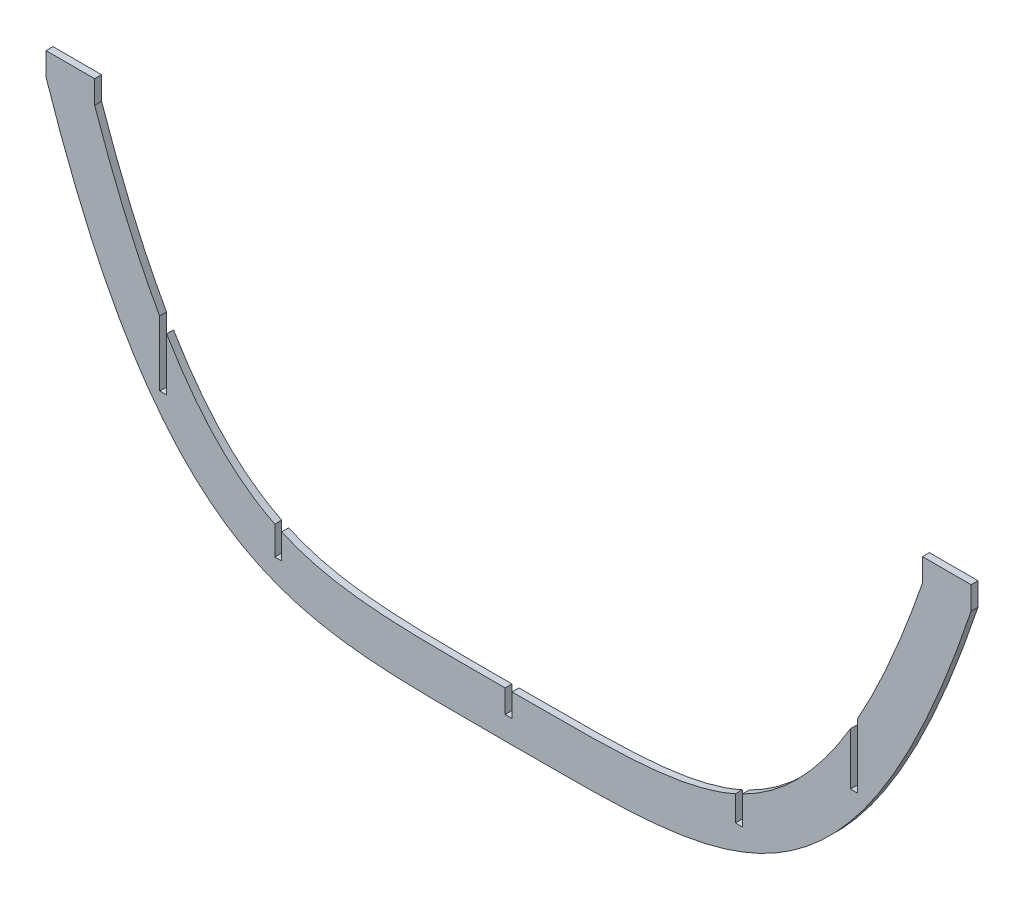
from build123d import *

# Parameters (mm, degrees)
BOSS_EXTRUDE1_DEPTH = 3
SKETCH2_W           = 2.999999902
SKETCH2_H           = 11.368148841
CUT_EXTRUDE2_DEPTH  = 22
SKETCH4_W           = 3
SKETCH4_H           = 12.91245629
CUT_EXTRUDE3_DEPTH  = 45
SKETCH5_W           = 3
SKETCH5_H           = 17.735525731
CUT_EXTRUDE4_DEPTH  = 38
SKETCH6_W           = 3
SKETCH6_H           = 30.838195809
CUT_EXTRUDE5_DEPTH  = 99
CUT_EXTRUDE6_DEPTH  = 239


with BuildPart() as part:
    # Sketch1 → Boss-Extrude1 (new body)
    with BuildSketch(Plane.XY):
        with BuildLine():
            Line((-200.857104714, 149.999999933), (-200.857104714, 159.999999933))
            Line((-200.857104714, 159.999999933), (-179.730541017, 159.999999933))
            Line((-179.730541017, 159.999999933), (-179.730541017, 149.999999952))
            add(Edge.make_bspline(
                [(-179.730541017, 149.999999952), (-179.435736312, 149.148237058), (-178.129369157, 145.400432959), (-175.809971558, 138.948879894), (-172.785816957, 130.935113712), (-168.767754052, 120.798312408), (-163.776796791, 109.130589637), (-157.847435598, 96.632896439), (-151.989239929, 85.54140938), (-144.288735397, 72.497307518), (-134.900677695, 59.219307644), (-124.086780396, 47.326283664), (-113.706041623, 38.64424455), (-103.59432148, 32.380752321), (-93.477134718, 27.890378411), (-83.091397363, 24.726267775), (-68.685014669, 21.878302713), (-49.516353479, 20.30417739), (-25.106590611, 19.975287666), (-1.8e-08, 20.012356167), (25.106590577, 19.975287666), (49.516353446, 20.304177388), (68.685014637, 21.878302709), (83.091397333, 24.726267767), (93.477134689, 27.8903784), (103.594321452, 32.380752306), (113.706041594, 38.644244529), (124.086780366, 47.326283635), (134.900677664, 59.219307605), (144.288735365, 72.497307468), (151.989239896, 85.541409321), (157.847435565, 96.632896373), (163.776796758, 109.130589562), (168.767754018, 120.798312326), (172.785816923, 130.935113624), (175.809971524, 138.948879801), (178.129369121, 145.400432856), (179.435736274, 149.148236946), (179.730540976, 149.999999832)],
                knots=[0.041921013, 0.041921013, 0.041921013, 0.041921013, 0.044025323, 0.051263016, 0.05850071, 0.065738403, 0.080213789, 0.094689176, 0.109164563, 0.123639949, 0.152590722, 0.181541495, 0.210492269, 0.239443042, 0.268393815, 0.297344588, 0.326295361, 0.384196907, 0.442098454, 0.5, 0.557901546, 0.615803093, 0.673704639, 0.702655412, 0.731606185, 0.760556958, 0.789507731, 0.818458504, 0.847409278, 0.876360051, 0.890835437, 0.905310824, 0.91978621, 0.934261597, 0.94149929, 0.948736984, 0.955974677, 0.958078987, 0.958078987, 0.958078987, 0.958078987], degree=3))
            Line((179.730540976, 149.999999832), (179.730540976, 159.999999832))
            Line((179.730540976, 159.999999832), (200.857104679, 159.999999832))
            Line((200.857104679, 159.999999832), (200.857104679, 149.999999828))
            add(Edge.make_bspline(
                [(-200.857104714, 149.999999933), (-100.428552366, -149.999999904), (-1.8e-08, 149.999999877), (100.428552329, -149.999999851), (200.857104679, 149.999999828)],
                knots=[0.03678763, 0.03678763, 0.03678763, 0.03678763, 0.03678763, 0.96321237, 0.96321237, 0.96321237, 0.96321237, 0.96321237], degree=4))
        make_face()
    extrude(amount=BOSS_EXTRUDE1_DEPTH)

    # Sketch2 → Cut-Extrude2 (cut)
    with BuildSketch(Plane.XY):
        with Locations((-4.4e-08, 15.684087839)):
            Rectangle(SKETCH2_W, SKETCH2_H)
    extrude(amount=CUT_EXTRUDE2_DEPTH, mode=Mode.SUBTRACT)

    # Sketch4 → Cut-Extrude3 (cut)
    with BuildSketch(Plane.XY):
        with Locations((99.999999956, 25.672228128)):
            Rectangle(SKETCH4_W, SKETCH4_H)
    extrude(amount=CUT_EXTRUDE3_DEPTH, mode=Mode.SUBTRACT)

    # Sketch5 → Cut-Extrude4 (cut)
    with BuildSketch(Plane.XY):
        with Locations((-100, 28.083762866)):
            Rectangle(SKETCH5_W, SKETCH5_H)
    extrude(amount=CUT_EXTRUDE4_DEPTH, mode=Mode.SUBTRACT)

    # Sketch6 → Cut-Extrude5 (cut)
    with BuildSketch(Plane.XY):
        with Locations((-150, 72.075097905)):
            Rectangle(SKETCH6_W, SKETCH6_H)
    extrude(amount=CUT_EXTRUDE5_DEPTH, mode=Mode.SUBTRACT)

    # Sketch7 → Cut-Extrude6 (cut)
    with BuildSketch(Plane.XY):
        Polygon((148.499999956, 59.949736331), (148.499999956, 86.674548715), (151.499999956, 86.674548715), (151.499999956, 59.949736331), (151.499999956, 56.949736331), (148.499999956, 56.949736331), align=None)
    extrude(amount=CUT_EXTRUDE6_DEPTH, mode=Mode.SUBTRACT)


solid = part.part
